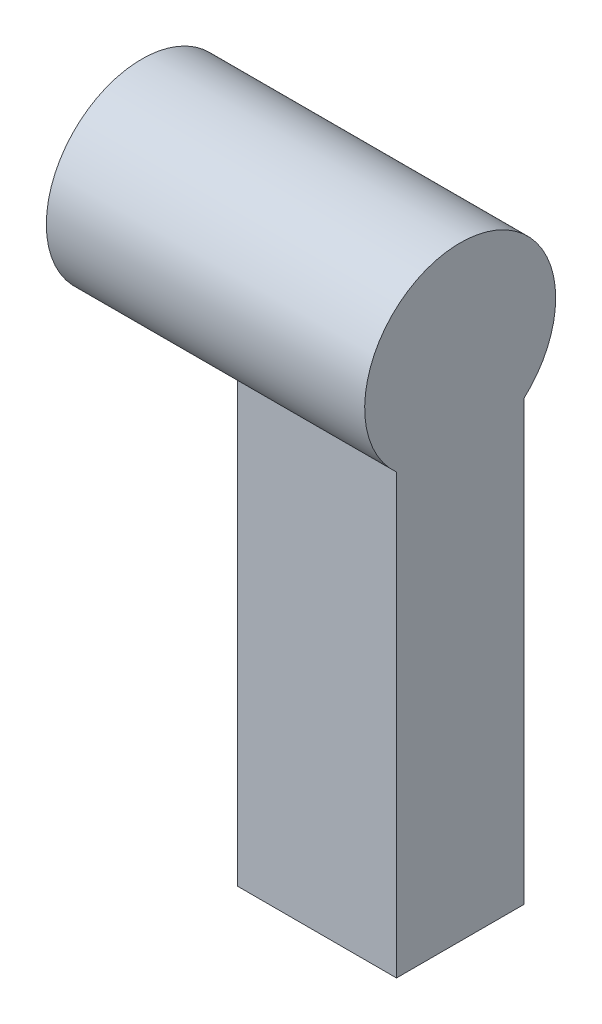
from build123d import *

# Parameters (mm, degrees)
SKETCH1_R           = 15
BOSS_EXTRUDE1_DEPTH = 50
SKETCH2_W           = 25
SKETCH2_H           = 20
BOSS_EXTRUDE2_DEPTH = 80
SKETCH3_R           = 9
CUT_EXTRUDE2_DEPTH  = 10


with BuildPart() as part:
    # Sketch1 → Boss-Extrude1 (new body)
    with BuildSketch(Plane(origin=(0, 0, 0), x_dir=(0, 0, -1), z_dir=(1, 0, 0))):
        Circle(SKETCH1_R)
    extrude(amount=-BOSS_EXTRUDE1_DEPTH)

    # Sketch2 → Boss-Extrude2 (add)
    with BuildSketch(Plane(origin=(0, 0, 0), x_dir=(1, 0, 0), z_dir=(0, 1, 0))):
        with Locations((-12.5, 0)):
            Rectangle(SKETCH2_W, SKETCH2_H)
    extrude(amount=-BOSS_EXTRUDE2_DEPTH)

    # Sketch3 → Cut-Extrude2 (cut)
    with BuildSketch(Plane.XZ.offset(80)):
        with Locations(Location((-12.5, 0, 0), (0, 0, 270))):
            Circle(SKETCH3_R)
    extrude(amount=-CUT_EXTRUDE2_DEPTH, mode=Mode.SUBTRACT)


solid = part.part
